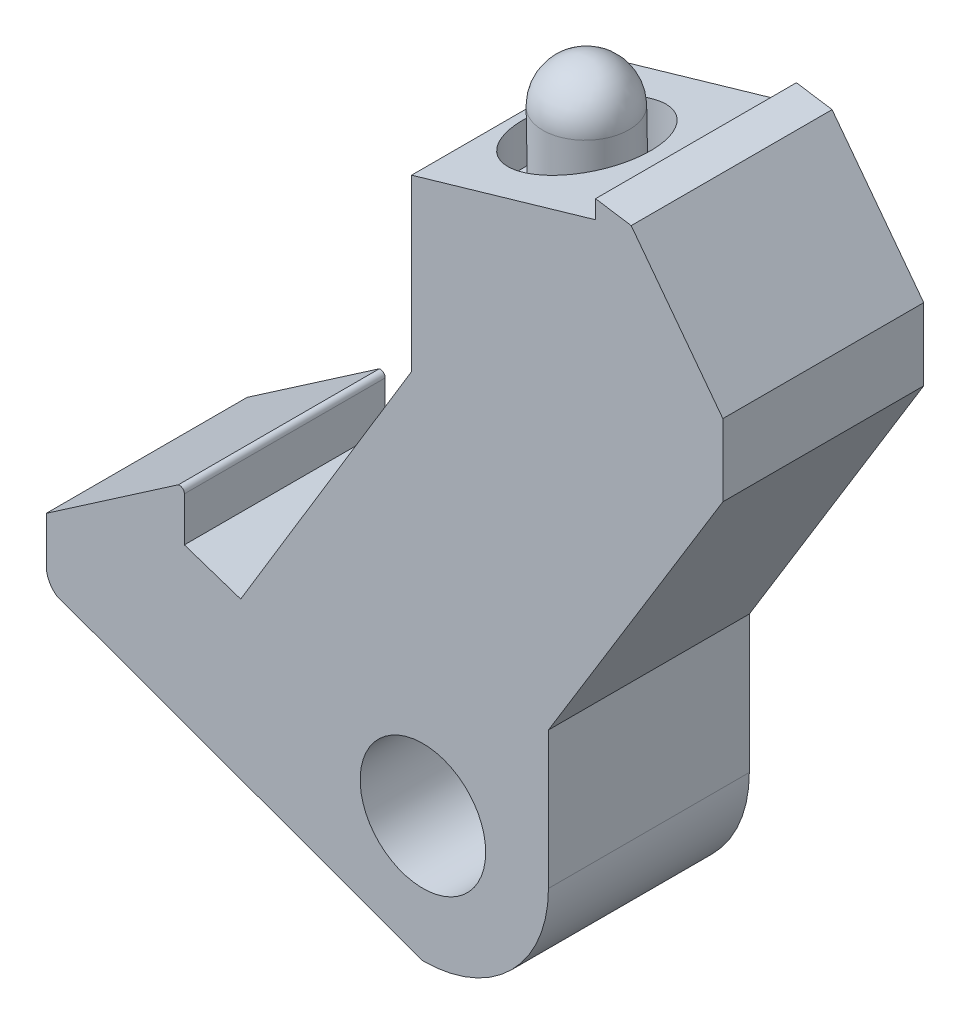
from build123d import *

# Parameters (mm, degrees)
SKETCH_1_R          = 2.5
EXTRUDE_1_DEPTH     = 8
SKETCH_5_R          = 3
CUT_EXTRUDE_2_DEPTH = 3
SKETCH_7_R          = 2
EXTRUDE_3_DEPTH     = 3
FILLET_5_R          = 2
SKETCH_9_R          = 2.55
CUT_EXTRUDE_3_DEPTH = 1.5
SKETCH_10_R         = 1.7
EXTRUDE_4_DEPTH     = 5
FILLET_6_R          = 1.7


with BuildPart() as part:
    # 스케치1 → 보스-돌출1 (new body)
    with BuildSketch(Plane.XY):
        with BuildLine():
            Line((6.875581969, 24), (-0.451148657, 21.875531488))
            Line((-0.451148657, 21.875531488), (-0.451148657, 15.101495802))
            Line((-0.451148657, 15.101495802), (-7.258120431, 3.851310171))
            Line((-7.258120431, 3.851310171), (-9.5, 4.598603361))
            Line((-9.5, 4.598603361), (-9.5, 6.358960817))
            ThreePointArc((-9.5, 6.358960817), (-9.571850512, 6.512511163), (-9.735777088, 6.555734799))
            Line((-9.735777088, 6.555734799), (-15, 2.937976957))
            Line((-15, 2.937976957), (-15, 1.111926907))
            ThreePointArc((-15, 1.111926907), (-14.889635684, 0.655255963), (-14.582903299, 0.299385373))
            Line((-14.582903299, 0.299385373), (0, -5))
            ThreePointArc((0, -5), (3.535533906, -3.535533906), (5, 0))
            Line((5, 0), (5, 3.83484861))
            Line((5, 3.83484861), (5, 5.464934457))
            Line((5, 5.464934457), (10.112329073, 13.81338505))
            Line((10.112329073, 13.81338505), (11.945796901, 16.807444187))
            Line((11.945796901, 16.807444187), (11.945796901, 19.676308628))
            Line((11.945796901, 19.676308628), (8.295575886, 24.508809453))
            Line((8.295575886, 24.508809453), (6.875581969, 24.728164545))
            Line((6.875581969, 24.728164545), (6.875581969, 24))
        make_face()
        Circle(SKETCH_1_R, mode=Mode.SUBTRACT)
    extrude(amount=EXTRUDE_1_DEPTH)

    # 스케치5 → 컷-돌출2 (cut)
    with BuildSketch(Plane(origin=(-1.605029546, -4.416736851, 0), x_dir=(0.9398656128397294, -0.34154447704713375, 0), z_dir=(-0.34154447704713375, -0.9398656128397295, 0))):
        with Locations((-9.929236479, 4)):
            Circle(SKETCH_5_R)
    extrude(amount=-CUT_EXTRUDE_2_DEPTH, mode=Mode.SUBTRACT)

    # 스케치7 → 보스-돌출3 (add)
    with BuildSketch(Plane(origin=(-0.580396115, -1.597140012, 0), x_dir=(0.9398656128397294, -0.34154447704713387, 0), z_dir=(-0.34154447704713387, -0.9398656128397294, 0))):
        with Locations((-9.929236479, 4)):
            Circle(SKETCH_7_R)
    extrude(amount=EXTRUDE_3_DEPTH)

    # 필렛5
    fillet_5_edges = [part.edges().sort_by_distance(p)[0] for p in [
        (-12.8169087, -0.342372016, 4),
    ]]
    fillet(fillet_5_edges, radius=FILLET_5_R)

    # 스케치9 → 컷-돌출3 (cut, symmetric)
    with BuildSketch(Plane(origin=(-0.449080246, 21.87557395, 0), x_dir=(-0.9997893498603082, -0.02052451962658901, 0), z_dir=(0.02052451962658901, -0.9997893498603082, 0))):
        with Locations(Location((-2.997931152, -4, 0), (0, 0, 180))):
            Circle(SKETCH_9_R)
    extrude(amount=CUT_EXTRUDE_3_DEPTH, both=True, mode=Mode.SUBTRACT)

    # 스케치10 → 보스-돌출4 (add)
    with BuildSketch(Plane(origin=(-0.418293466, 20.375889925, 0), x_dir=(0.9997893498603082, 0.020524519626589015, 0), z_dir=(-0.020524519626589015, 0.9997893498603082, 0))):
        with Locations((2.997931152, -4)):
            Circle(SKETCH_10_R)
    extrude(amount=EXTRUDE_4_DEPTH)

    # 필렛6
    fillet_6_edges = [part.edges().sort_by_distance(p)[0] for p in [
        (0.776741679, 25.401476088, 4),
    ]]
    fillet(fillet_6_edges, radius=FILLET_6_R)


solid = part.part
